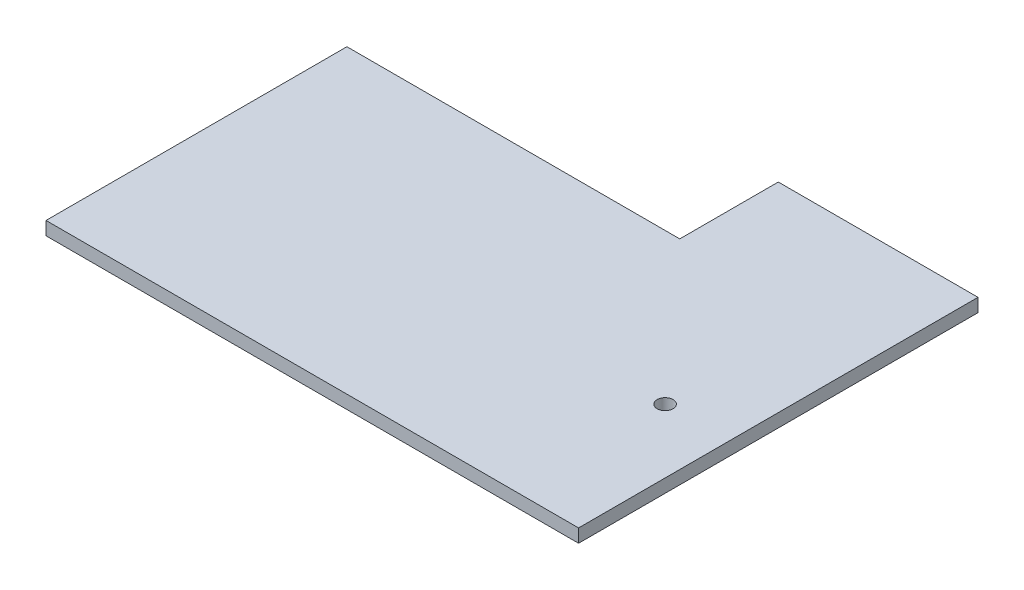
from build123d import *

# Parameters (mm, degrees)
SZKIC1_W                    = 200
SZKIC1_H                    = 5
SZKIC1_W_2                  = 46
SZKIC1_H_2                  = 37
SZKIC1_W_3                  = 24
SZKIC1_W_4                  = 125
DODANIE_WYCI_GNI_CIE1_DEPTH = 5


with BuildPart() as part:
    # Szkic1 → Dodanie-wyciągnięcie1 (new body)
    with BuildSketch(Plane(origin=(0, 0, 0), x_dir=(1, 0, 0), z_dir=(0, 1, 0))):
        with Locations((-8.765553919, -32.5)):
            Rectangle(SZKIC1_W, SZKIC1_H)
        with Locations((44.234446081, 91.5)):
            Rectangle(SZKIC1_W_2, SZKIC1_H_2)
        with Locations((79.234446081, 91.5)):
            Rectangle(SZKIC1_W_3, SZKIC1_H_2)
        with Locations((-46.265553919, 75.5)):
            Rectangle(SZKIC1_W_4, SZKIC1_H)
        Polygon((16.234446081, 73), (21.234446081, 73), (21.234446081, 110), (21.234446081, 115), (16.234446081, 115), (16.234446081, 78), align=None)
        Polygon((67.234446081, 110), (91.234446081, 110), (91.234446081, 115), (21.234446081, 115), (21.234446081, 110), align=None)
        with BuildLine():
            Line((91.234446081, -30), (91.234446081, 21.5))
            Line((91.234446081, 21.5), (70.234446081, 21.5))
            ThreePointArc((70.234446081, 21.5), (65.113125737, 19.378679656), (67.234446081, 24.5))
            Line((67.234446081, 24.5), (67.234446081, 73))
            Line((67.234446081, 73), (21.234446081, 73))
            Line((21.234446081, 73), (16.234446081, 73))
            Line((16.234446081, 73), (-108.765553919, 73))
            Line((-108.765553919, 73), (-108.765553919, -30))
            Line((-108.765553919, -30), (91.234446081, -30))
        make_face()
        with BuildLine():
            Line((70.234446081, 21.5), (91.234446081, 21.5))
            Line((91.234446081, 21.5), (91.234446081, 73))
            Line((91.234446081, 73), (67.234446081, 73))
            Line((67.234446081, 73), (67.234446081, 24.5))
            ThreePointArc((67.234446081, 24.5), (69.355766424, 23.621320344), (70.234446081, 21.5))
        make_face()
    extrude(amount=-DODANIE_WYCI_GNI_CIE1_DEPTH)


solid = part.part
